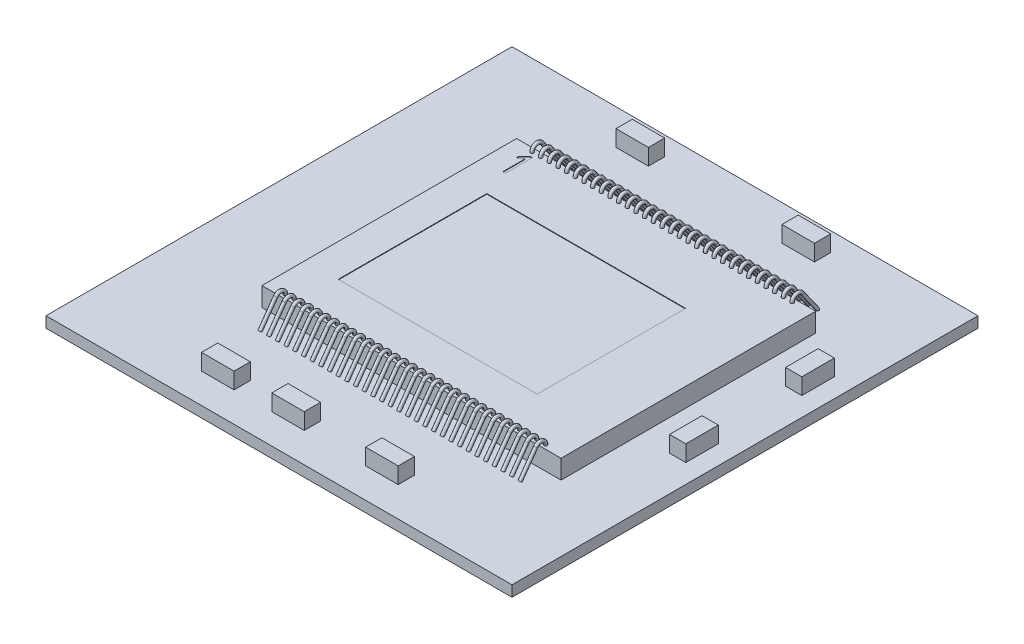
from build123d import *

# Parameters (mm, degrees)
SKIZZE1_W                   = 5.52
SKIZZE1_H                   = 4.7
CHIP_DIE_DEPTH              = 0.35
SKIZZE4_W                   = 3.67
SKIZZE4_H                   = 2.74
ACTIVE_AREA_DEPTH           = 0.01
PIN1_DEPTH                  = 0.01
SKIZZE6_W                   = 8.6
SKIZZE6_H                   = 8.6
BASE_PLATE_DEPTH            = 0.2
SKIZZE13_R                  = 0.03
SKIZZE14_W                  = 0.6
SKIZZE14_H                  = 0.3
SKIZZE14_W_2                = 0.3
SKIZZE14_H_2                = 0.6
ELECTRONIC_COMPONENTS_DEPTH = 0.3


with BuildPart() as part:
    # Skizze1 → Chip_Die (new body)
    with BuildSketch(Plane(origin=(0, 0, 0), x_dir=(1, 0, 0), z_dir=(0, 1, 0))):
        Rectangle(SKIZZE1_W, SKIZZE1_H)
    extrude(amount=CHIP_DIE_DEPTH)

    # Skizze4 → Active_Area (cut)
    with BuildSketch(Plane(origin=(0, 0.35, 0), x_dir=(1, 0, 0), z_dir=(0, 1, 0))):
        with Locations((-0.32, -0.175)):
            Rectangle(SKIZZE4_W, SKIZZE4_H)
    extrude(amount=-ACTIVE_AREA_DEPTH, mode=Mode.SUBTRACT)

    # Skizze5 → Pin1 (cut)
    with BuildSketch(Plane(origin=(0, 0.35, 0), x_dir=(1, 0, 0), z_dir=(0, 1, 0))):
        with BuildLine():
            Line((-2.357101993, 2.106176307), (-2.414356458, 2.048921843))
            add(Edge.make_bspline(
                [(-2.414356458, 2.048921843), (-2.41558148, 2.047825919), (-2.41797629, 2.045683486), (-2.422242966, 2.043408791), (-2.426881736, 2.042023199), (-2.430120538, 2.041861298), (-2.431767172, 2.041778986)],
                knots=[0, 0, 0, 0, 1.018353941, 1.990791669, 2.978501366, 4, 4, 4, 4], degree=3))
            add(Edge.make_bspline(
                [(-2.431767172, 2.041778986), (-2.433711964, 2.041810316), (-2.437386426, 2.041869511), (-2.442458748, 2.043177127), (-2.446899665, 2.045001386), (-2.4503836, 2.047939343), (-2.453321557, 2.051423278), (-2.455145817, 2.055864195), (-2.456453432, 2.060936517), (-2.456512627, 2.064610979), (-2.456543958, 2.066555771)],
                knots=[0, 0, 0, 0, 1.158343618, 2.188557439, 3.114345967, 4, 4.885654033, 5.811442561, 6.841656382, 8, 8, 8, 8], degree=3))
            add(Edge.make_bspline(
                [(-2.456543958, 2.066555771), (-2.456461646, 2.068202406), (-2.456299744, 2.071441208), (-2.454914152, 2.076079977), (-2.452639457, 2.080346653), (-2.450497024, 2.082741463), (-2.449401101, 2.083966486)],
                knots=[0, 0, 0, 0, 1.021498634, 2.009208331, 2.981646059, 4, 4, 4, 4], degree=3))
            Line((-2.449401101, 2.083966486), (-2.352191279, 2.181622736))
            add(Edge.make_bspline(
                [(-2.352191279, 2.181622736), (-2.350611043, 2.18314872), (-2.347620367, 2.186036721), (-2.342464678, 2.189017516), (-2.337365943, 2.191171267), (-2.333833774, 2.191354384), (-2.332101993, 2.191444164)],
                knots=[0, 0, 0, 0, 1.143618958, 2.164355411, 3.100005221, 4, 4, 4, 4], degree=3))
            add(Edge.make_bspline(
                [(-2.332101993, 2.191444164), (-2.330118795, 2.191417626), (-2.326404942, 2.19136793), (-2.321274026, 2.19001897), (-2.316766965, 2.18825574), (-2.313266562, 2.185279596), (-2.310290418, 2.181779193), (-2.308527187, 2.177272132), (-2.307178228, 2.172141215), (-2.307128531, 2.168427362), (-2.307101993, 2.166444164)],
                knots=[0, 0, 0, 0, 1.168121455, 2.187492668, 3.123667138, 4, 4.876332862, 5.812507332, 6.831878545, 8, 8, 8, 8], degree=3))
            Line((-2.307101993, 2.166444164), (-2.307101993, 1.716444164))
            add(Edge.make_bspline(
                [(-2.307101993, 1.716444164), (-2.307138501, 1.714501184), (-2.307208159, 1.710793888), (-2.308470805, 1.705664739), (-2.310366712, 1.701200671), (-2.313182372, 1.697592478), (-2.316843288, 1.694796894), (-2.321218561, 1.692790376), (-2.326434692, 1.691712558), (-2.330125466, 1.691537769), (-2.332101993, 1.691444164)],
                knots=[0, 0, 0, 0, 1.147825403, 2.190104258, 3.107486261, 4.002358969, 4.866307497, 5.812869616, 6.828721528, 8, 8, 8, 8], degree=3))
            add(Edge.make_bspline(
                [(-2.332101993, 1.691444164), (-2.334038545, 1.69154681), (-2.337723047, 1.691742105), (-2.342937502, 1.692733919), (-2.347269511, 1.694873505), (-2.351037696, 1.697508461), (-2.353672652, 1.701276646), (-2.355812239, 1.705608656), (-2.356804052, 1.71082311), (-2.356999348, 1.714507613), (-2.357101993, 1.716444164)],
                knots=[0, 0, 0, 0, 1.150813752, 2.189550435, 3.117366144, 4, 4.882633856, 5.810449565, 6.849186248, 8, 8, 8, 8], degree=3))
            Line((-2.357101993, 1.716444164), (-2.357101993, 2.106176307))
        make_face()
    extrude(amount=-PIN1_DEPTH, mode=Mode.SUBTRACT)

    # Skizze6 → Base-Plate (add)
    with BuildSketch(Plane(origin=(0, 0, 0), x_dir=(1, 0, 0), z_dir=(0, 1, 0))):
        with Locations((-0.32, -0.175)):
            Rectangle(SKIZZE6_W, SKIZZE6_H)
    extrude(amount=-BASE_PLATE_DEPTH)

    # Bonding-wires: sweep along a path in Skizze12
    with BuildLine(Plane(origin=(0, 0, 0), x_dir=(0, 0, -1), z_dir=(1, 0, 0))) as bonding_wires_path:
        Line((-2.745842332, 0), (-2.456320682, 0.407882256))
        ThreePointArc((-2.456320682, 0.407882256), (-2.34439882, 0.445274696), (-2.27477533, 0.35))
    # Skizze13 → Bonding-wires (sweep)
    with BuildSketch(Plane(origin=(0, 0.35, 0), x_dir=(1, 0, 0), z_dir=(0, 1, 0))):
        with Locations((0, -2.27477533)):
            Circle(SKIZZE13_R)
        with Locations((0.16, -2.27477533)):
            Circle(SKIZZE13_R)
        with Locations((0.32, -2.27477533)):
            Circle(SKIZZE13_R)
        with Locations((0.48, -2.27477533)):
            Circle(SKIZZE13_R)
        with Locations((0.64, -2.27477533)):
            Circle(SKIZZE13_R)
        with Locations((0.8, -2.27477533)):
            Circle(SKIZZE13_R)
        with Locations((0.96, -2.27477533)):
            Circle(SKIZZE13_R)
        with Locations((1.12, -2.27477533)):
            Circle(SKIZZE13_R)
        with Locations((1.28, -2.27477533)):
            Circle(SKIZZE13_R)
        with Locations((1.44, -2.27477533)):
            Circle(SKIZZE13_R)
        with Locations((1.6, -2.27477533)):
            Circle(SKIZZE13_R)
        with Locations((1.76, -2.27477533)):
            Circle(SKIZZE13_R)
        with Locations((1.92, -2.27477533)):
            Circle(SKIZZE13_R)
        with Locations((2.08, -2.27477533)):
            Circle(SKIZZE13_R)
        with Locations((2.24, -2.27477533)):
            Circle(SKIZZE13_R)
        with Locations((2.4, -2.27477533)):
            Circle(SKIZZE13_R)
        with Locations((-2.4, -2.27477533)):
            Circle(SKIZZE13_R)
        with Locations((-2.24, -2.27477533)):
            Circle(SKIZZE13_R)
        with Locations((-2.08, -2.27477533)):
            Circle(SKIZZE13_R)
        with Locations((-1.92, -2.27477533)):
            Circle(SKIZZE13_R)
        with Locations((-1.76, -2.27477533)):
            Circle(SKIZZE13_R)
        with Locations((-1.6, -2.27477533)):
            Circle(SKIZZE13_R)
        with Locations((-1.44, -2.27477533)):
            Circle(SKIZZE13_R)
        with Locations((-1.28, -2.27477533)):
            Circle(SKIZZE13_R)
        with Locations((-1.12, -2.27477533)):
            Circle(SKIZZE13_R)
        with Locations((-0.96, -2.27477533)):
            Circle(SKIZZE13_R)
        with Locations((-0.8, -2.27477533)):
            Circle(SKIZZE13_R)
        with Locations((-0.64, -2.27477533)):
            Circle(SKIZZE13_R)
        with Locations((-0.48, -2.27477533)):
            Circle(SKIZZE13_R)
        with Locations((-0.32, -2.27477533)):
            Circle(SKIZZE13_R)
        with Locations((-0.16, -2.27477533)):
            Circle(SKIZZE13_R)
    bonding_wires = sweep(path=bonding_wires_path.line)

    # Spiegeln1: Bonding-wires across plane
    add(bonding_wires.mirror(Plane.XY))

    # Skizze14 → Electronic_components (add)
    with BuildSketch(Plane(origin=(0, 0, 0), x_dir=(1, 0, 0), z_dir=(0, 1, 0))):
        with Locations((-1.999418048, -3.775)):
            Rectangle(SKIZZE14_W, SKIZZE14_H)
        with Locations((-0.703560794, -3.775)):
            Rectangle(SKIZZE14_W, SKIZZE14_H)
        with Locations((1.029102277, -3.775)):
            Rectangle(SKIZZE14_W, SKIZZE14_H)
        with Locations((3.48, -0.61809576)):
            Rectangle(SKIZZE14_W_2, SKIZZE14_H_2)
        with Locations((3.48, 1.52363245)):
            Rectangle(SKIZZE14_W_2, SKIZZE14_H_2)
        with Locations((-1.75145144, 3.625)):
            Rectangle(SKIZZE14_W, SKIZZE14_H)
        with Locations((1.311955252, 3.625)):
            Rectangle(SKIZZE14_W, SKIZZE14_H)
    extrude(amount=ELECTRONIC_COMPONENTS_DEPTH)


solid = part.part
